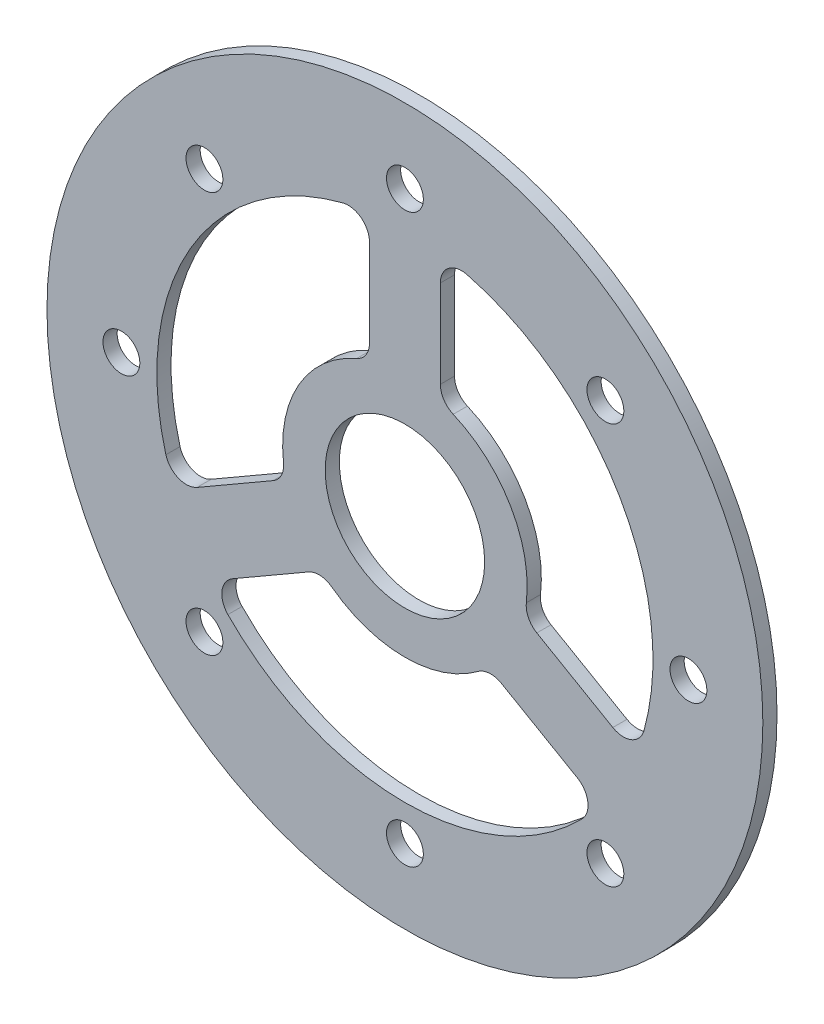
from build123d import *

# Parameters (mm, degrees)
SKETCH_1_R      = 50.5
SKETCH_1_R_2    = 2.6
SKETCH_1_R_3    = 35
EXTRUDE_1_DEPTH = 2
EXTRUDE_START   = -2
SKETCH_2_R      = 11.25
EXTRUDE_3_DEPTH = 2
FILLET_1_R      = 3


with BuildPart() as part:
    # 草图1 → 凸台-拉伸1 (new body)
    with BuildSketch(Plane.XY):
        Circle(SKETCH_1_R)
        with Locations((0, 40)):
            Circle(SKETCH_1_R_2, mode=Mode.SUBTRACT)
        Circle(SKETCH_1_R_3, mode=Mode.SUBTRACT)
        with Locations((28.284271247, 28.284271247)):
            Circle(SKETCH_1_R_2, mode=Mode.SUBTRACT)
        with Locations((40, 0)):
            Circle(SKETCH_1_R_2, mode=Mode.SUBTRACT)
        with Locations((28.284271247, -28.284271247)):
            Circle(SKETCH_1_R_2, mode=Mode.SUBTRACT)
        with Locations((0, -40)):
            Circle(SKETCH_1_R_2, mode=Mode.SUBTRACT)
        with Locations((-28.284271247, -28.284271247)):
            Circle(SKETCH_1_R_2, mode=Mode.SUBTRACT)
        with Locations((-40, 0)):
            Circle(SKETCH_1_R_2, mode=Mode.SUBTRACT)
        with Locations((-28.284271247, 28.284271247)):
            Circle(SKETCH_1_R_2, mode=Mode.SUBTRACT)
    extrude(amount=EXTRUDE_1_DEPTH)

    # 草图2 → 凸台-拉伸3 (add)
    with BuildSketch(Plane.XY.offset(2).offset(EXTRUDE_START)):
        with BuildLine():
            ThreePointArc((5, 34.641016151), (0, 35), (-5, 34.641016151))
            Line((-5, 34.641016151), (-5, 16.509466981))
            ThreePointArc((-5, 16.509466981), (-14.938938215, 8.625), (-16.797617809, -3.924606472))
            Line((-16.797617809, -3.924606472), (-32.5, -12.990381057))
            ThreePointArc((-32.5, -12.990381057), (-30.310889132, -17.5), (-27.5, -21.650635095))
            Line((-27.5, -21.650635095), (-11.797617809, -12.584860509))
            ThreePointArc((-11.797617809, -12.584860509), (0, -17.25), (11.797617809, -12.584860509))
            Line((11.797617809, -12.584860509), (27.5, -21.650635095))
            ThreePointArc((27.5, -21.650635095), (30.310889132, -17.5), (32.5, -12.990381057))
            Line((32.5, -12.990381057), (16.797617809, -3.924606472))
            ThreePointArc((16.797617809, -3.924606472), (14.938938215, 8.625), (5, 16.509466981))
            Line((5, 16.509466981), (5, 34.641016151))
        make_face()
        Circle(SKETCH_2_R, mode=Mode.SUBTRACT)
    extrude(amount=EXTRUDE_3_DEPTH)

    # 圆角1
    fillet_1_edges = [part.edges().sort_by_distance(p)[0] for p in [
        (-16.797617809, -3.924606472, 1),
        (-32.5, -12.990381057, 1),
        (-27.5, -21.650635095, 1),
        (-11.797617809, -12.584860509, 1),
        (11.797617809, -12.584860509, 1),
        (27.5, -21.650635095, 1),
        (32.5, -12.990381057, 1),
        (16.797617809, -3.924606472, 1),
        (5, 16.509466981, 1),
        (5, 34.641016151, 1),
        (-5, 34.641016151, 1),
        (-5, 16.509466981, 1),
    ]]
    fillet(fillet_1_edges, radius=FILLET_1_R)


solid = part.part
